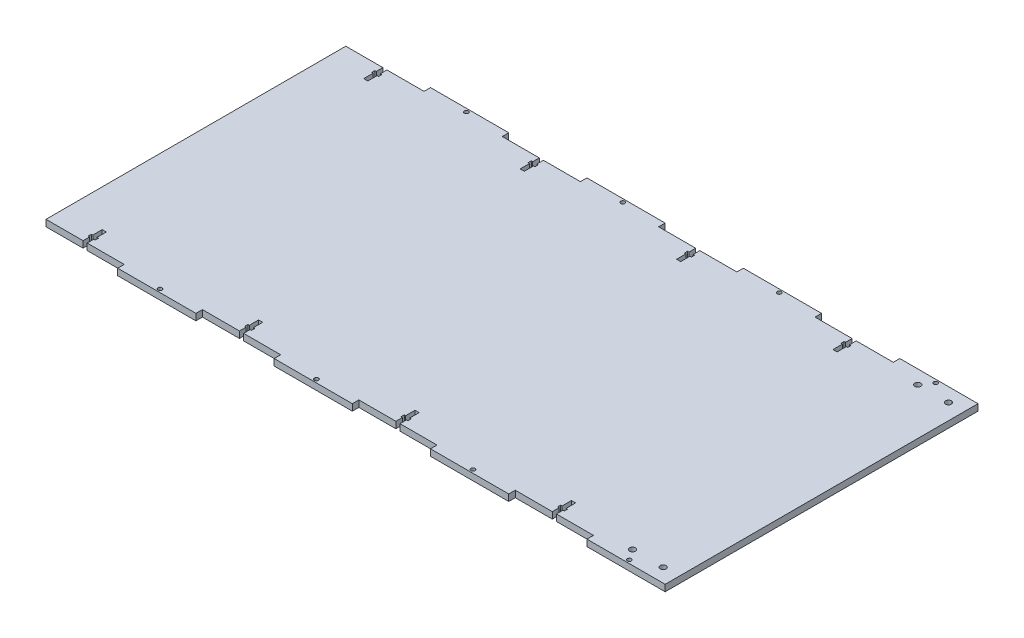
from build123d import *

# Parameters (mm, degrees)
SKETCH1_W           = 609.6
SKETCH1_H           = 152.4
BOSS_EXTRUDE1_DEPTH = 3.175
SKETCH2_R           = 2.875
SKETCH2_R_2         = 2
CUT_EXTRUDE1_DEPTH  = 341.835917268


with BuildPart() as part:
    # Sketch1 → Boss-Extrude1 (new, symmetric)
    with BuildSketch(Plane(origin=(0, 0, 0), x_dir=(1, 0, 0), z_dir=(0, 1, 0))):
        with Locations((0, -76.2)):
            Rectangle(SKETCH1_W, SKETCH1_H)
    boss_extrude1 = extrude(amount=BOSS_EXTRUDE1_DEPTH, both=True)

    # Sketch2 → Cut-Extrude1 (cut, through all)
    with BuildSketch(Plane(origin=(0, -3.175, 0), x_dir=(1, 0, 0), z_dir=(0, 1, 0))):
        Polygon((34.71, -136.45), (34.71, -139.65), (36.1, -139.65), (36.1, -146.05), (0, -146.05), (0, -152.4), (76.2, -152.4), (76.2, -146.05), (40.1, -146.05), (40.1, -139.65), (41.49, -139.65), (41.49, -136.45), (40.1, -136.45), (40.1, -127.4), (36.1, -127.4), (36.1, -136.45), align=None)
        Polygon((-304.8, -146.05), (-304.8, -152.4), (-228.6, -152.4), (-228.6, -146.05), (-264.7, -146.05), (-264.7, -139.65), (-263.31, -139.65), (-263.31, -136.45), (-264.7, -136.45), (-264.7, -127.4), (-268.7, -127.4), (-268.7, -136.45), (-270.09, -136.45), (-270.09, -139.65), (-268.7, -139.65), (-268.7, -146.05), align=None)
        Polygon((-152.4, -146.05), (-152.4, -152.4), (-76.2, -152.4), (-76.2, -146.05), (-112.3, -146.05), (-112.3, -139.65), (-110.91, -139.65), (-110.91, -136.45), (-112.3, -136.45), (-112.3, -127.4), (-116.3, -127.4), (-116.3, -136.45), (-117.69, -136.45), (-117.69, -139.65), (-116.3, -139.65), (-116.3, -146.05), align=None)
        Polygon((152.4, -146.05), (152.4, -152.4), (228.6, -152.4), (228.6, -146.05), (192.5, -146.05), (192.5, -139.65), (193.89, -139.65), (193.89, -136.45), (192.5, -136.45), (192.5, -127.4), (188.5, -127.4), (188.5, -136.45), (187.11, -136.45), (187.11, -139.65), (188.5, -139.65), (188.5, -146.05), align=None)
        with Locations(Location((289.39, -138.999999876, 0), (0, 0, 90))):
            Circle(SKETCH2_R)
        with Locations(Location((259.53, -138.999999876, 0), (0, 0, 90))):
            Circle(SKETCH2_R)
        with Locations(Location((266.7, -149.225, 0), (0, 0, 90))):
            Circle(SKETCH2_R_2)
        with Locations(Location((114.3, -149.225, 0), (0, 0, 90))):
            Circle(SKETCH2_R_2)
        with Locations(Location((-38.1, -149.225, 0), (0, 0, 90))):
            Circle(SKETCH2_R_2)
        with Locations(Location((-190.5, -149.225, 0), (0, 0, 90))):
            Circle(SKETCH2_R_2)
    cut_extrude1 = extrude(amount=CUT_EXTRUDE1_DEPTH, mode=Mode.SUBTRACT)

    # Mirror1: Boss-Extrude1, Cut-Extrude1 across plane
    add(boss_extrude1.mirror(Plane(origin=(0, 3.175, 0), x_dir=(1, 0, 0), z_dir=(0, 0, 1))))
    add(cut_extrude1.mirror(Plane(origin=(0, 3.175, 0), x_dir=(1, 0, 0), z_dir=(0, 0, 1))), mode=Mode.SUBTRACT)


solid = part.part
